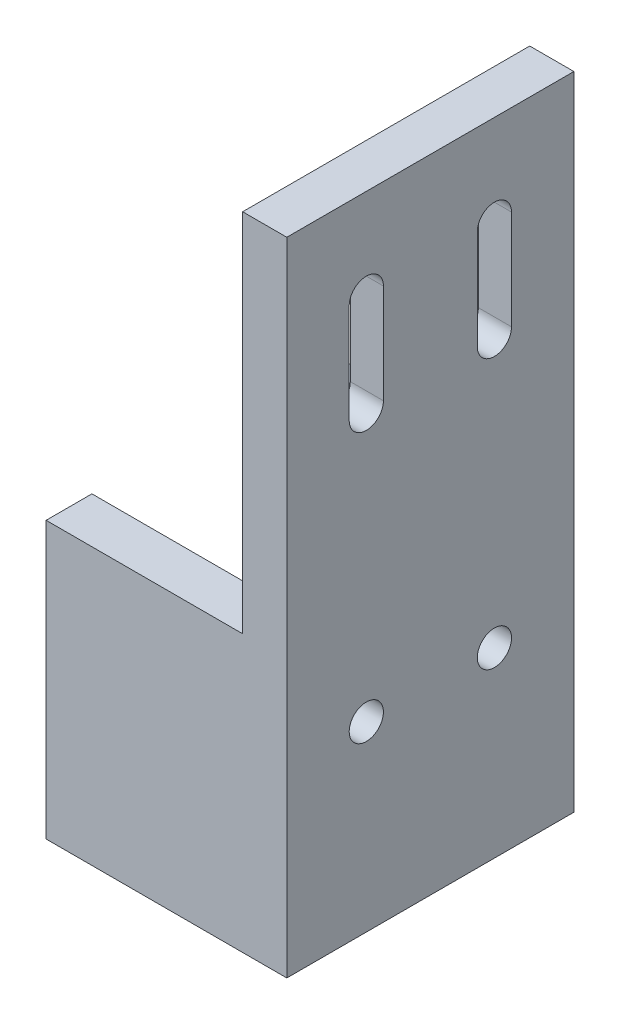
from build123d import *

# Parameters (mm, degrees)
PROFILESKETCH1_W                          = 4
PROFILESKETCH1_H                          = 58.1
BOSS_EXTRUDE1_DEPTH                       = 26
PROBESLIDINGMOUNTSKETCH4_R                = 1.55
PROBESLIDINGMOUNTCUT_EXTRUDE3_DEPTH       = 64.77781746
PROBESLIDINGMOUNTCHANELCUT_EXTRUDE4_DEPTH = 1
INDUCTIVEPROBEHOLDERSKETCH1_W             = 4.15
INDUCTIVEPROBEHOLDERSKETCH1_H             = 25
INDUCTIVEPROBEHOLDERBOSS_EXTRUDE2_DEPTH   = 17.8


with BuildPart() as part:
    # ProfileSketch1 → Boss-Extrude1 (new body)
    with BuildSketch(Plane.XY):
        with Locations((2, 29.05)):
            Rectangle(PROFILESKETCH1_W, PROFILESKETCH1_H)
    extrude(amount=BOSS_EXTRUDE1_DEPTH)

    # ProbeSlidingMountSketch4 → ProbeSlidingMountCut-Extrude3 (cut, through all)
    with BuildSketch(Plane.ZY):
        with Locations(Location((7.2, 16.5, 0), (0, 0, 270))):
            Circle(PROBESLIDINGMOUNTSKETCH4_R)
        with Locations(Location((18.8, 16.5, 0), (0, 0, 270))):
            Circle(PROBESLIDINGMOUNTSKETCH4_R)
        with BuildLine():
            Line((5.65, 49.9), (5.65, 40.9))
            ThreePointArc((5.65, 40.9), (7.2, 39.35), (8.75, 40.9))
            Line((8.75, 40.9), (8.75, 49.9))
            ThreePointArc((8.75, 49.9), (7.2, 51.45), (5.65, 49.9))
        make_face()
        with BuildLine():
            Line((17.25, 49.9), (17.25, 40.9))
            ThreePointArc((17.25, 40.9), (18.8, 39.35), (20.35, 40.9))
            Line((20.35, 40.9), (20.35, 49.9))
            ThreePointArc((20.35, 49.9), (18.8, 51.45), (17.25, 49.9))
        make_face()
    extrude(amount=-PROBESLIDINGMOUNTCUT_EXTRUDE3_DEPTH, mode=Mode.SUBTRACT)

    # ProbeSlidingMountChannelSketch5 → ProbeSlidingMountChanelCut-Extrude4 (cut)
    with BuildSketch(Plane.ZY):
        with BuildLine():
            Line((10.4, 49.9), (10.4, 40.9))
            ThreePointArc((10.4, 40.9), (7.2, 37.7), (4, 40.9))
            Line((4, 40.9), (4, 49.9))
            ThreePointArc((4, 49.9), (7.2, 53.1), (10.4, 49.9))
        make_face()
        with BuildLine():
            Line((22, 49.9), (22, 40.9))
            ThreePointArc((22, 40.9), (18.8, 37.7), (15.6, 40.9))
            Line((15.6, 40.9), (15.6, 49.9))
            ThreePointArc((15.6, 49.9), (18.8, 53.1), (22, 49.9))
        make_face()
    extrude(amount=-PROBESLIDINGMOUNTCHANELCUT_EXTRUDE4_DEPTH, mode=Mode.SUBTRACT)

    # InductiveProbeHolderSketch1 → InductiveProbeHolderBoss-Extrude2 (add)
    with BuildSketch(Plane.ZY):
        with Locations((2.075, 12.5)):
            Rectangle(INDUCTIVEPROBEHOLDERSKETCH1_W, INDUCTIVEPROBEHOLDERSKETCH1_H)
        with Locations((23.925, 12.5)):
            Rectangle(INDUCTIVEPROBEHOLDERSKETCH1_W, INDUCTIVEPROBEHOLDERSKETCH1_H)
    extrude(amount=INDUCTIVEPROBEHOLDERBOSS_EXTRUDE2_DEPTH)


solid = part.part
